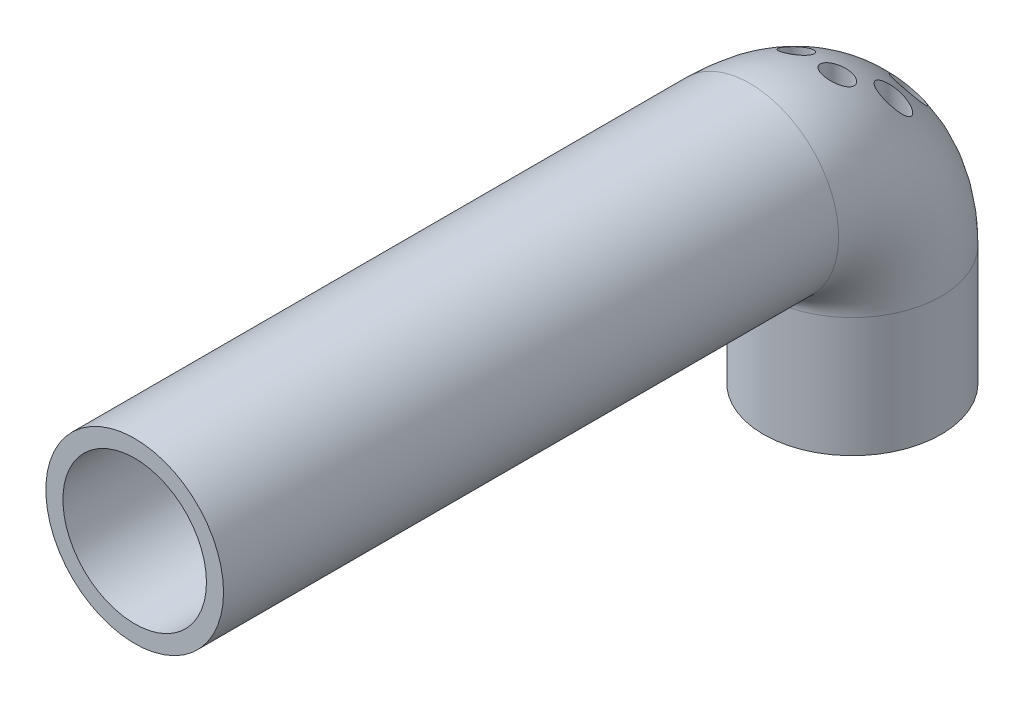
from build123d import *

# Parameters (mm, degrees)
SKETCH1_R                                       = 26
BOSS_EXTRUDE1_DEPTH                             = 5
CSK_FOR_M4_FLAT_HEAD_MACHINE_SCREW2_D           = 4.5
CSK_FOR_M4_FLAT_HEAD_MACHINE_SCREW2_CSINK_D     = 8
CSK_FOR_M4_FLAT_HEAD_MACHINE_SCREW2_CSINK_ANGLE = 90
SKETCH11_R                                      = 26
SKETCH11_R_2                                    = 21
SKETCH13_R                                      = 4
CUT_EXTRUDE1_DEPTH                              = 100
SKETCH14_R                                      = 2.9
CUT_EXTRUDE2_DEPTH                              = 1
BOSS_EXTRUDE2_START                             = 150
SKETCH15_R                                      = 26
SKETCH15_R_2                                    = 21
BOSS_EXTRUDE2_DEPTH                             = 150


with BuildPart() as part:
    # Sketch1 → Boss-Extrude1 (new body)
    with BuildSketch(Plane(origin=(0, 0, 0), x_dir=(1, 0, 0), z_dir=(0, 1, 0))):
        with Locations(Location((0, 0, 0), (0, 0, 270))):
            Circle(SKETCH1_R)
    extrude(amount=BOSS_EXTRUDE1_DEPTH)

    # CSK for M4 Flat Head Machine Screw2 (through all)
    with Locations(Plane(origin=(0, 5, 0), x_dir=(1, 0, 0), z_dir=(0, 1, 0))):
        with Locations((-6, 10.392304845), (-12, 0), (12, 0), (6, 10.392304845), (-6, -10.392304845), (6, -10.392304845)):
            CounterSinkHole(CSK_FOR_M4_FLAT_HEAD_MACHINE_SCREW2_D / 2, CSK_FOR_M4_FLAT_HEAD_MACHINE_SCREW2_CSINK_D / 2, counter_sink_angle=CSK_FOR_M4_FLAT_HEAD_MACHINE_SCREW2_CSINK_ANGLE)

    # Sweep3: sweep along a path in Sketch10
    with BuildLine(Plane(origin=(0, 0, 0), x_dir=(0, 0, -1), z_dir=(1, 0, 0))) as sweep3_path:
        Line((0, 5), (0, 35))
        ThreePointArc((0, 35), (-8.786796564, 56.213203436), (-30, 65))
        Line((-30, 65), (-60, 65))
    # Sketch11 → Sweep3 (sweep)
    with BuildSketch(Plane(origin=(0, 5, 0), x_dir=(1, 0, 0), z_dir=(0, 1, 0))):
        Circle(SKETCH11_R)
        Circle(SKETCH11_R_2, mode=Mode.SUBTRACT)
    sweep(path=sweep3_path.line)

    # Sketch13 → Cut-Extrude1 (cut)
    with BuildSketch(Plane(origin=(0, 39, 0), x_dir=(-1, 0, 0), z_dir=(0, -1, 0))):
        with Locations(Location((6, 10.392304845, 0), (0, 0, 69.705875047))):
            Circle(SKETCH13_R)
        with Locations(Location((-6, 10.392304845, 0), (0, 0, 74.301849625))):
            Circle(SKETCH13_R)
        with Locations(Location((-12, 0, 0), (0, 0, 58.652479001))):
            Circle(SKETCH13_R)
        with Locations(Location((-6, -10.392304845, 0), (0, 0, 55.656646254))):
            Circle(SKETCH13_R)
        with Locations(Location((6, -10.392304845, 0), (0, 0, 46.026357991))):
            Circle(SKETCH13_R)
        with Locations(Location((12, 0, 0), (0, 0, 43.940076892))):
            Circle(SKETCH13_R)
    extrude(amount=-CUT_EXTRUDE1_DEPTH, mode=Mode.SUBTRACT)

    # Sketch14 → Cut-Extrude2 (cut)
    with BuildSketch(Plane.XZ):
        with Locations(Location((0, 8.85, 0), (0, 0, 270))):
            Circle(SKETCH14_R)
        with Locations(Location((7.664324823, -4.425, 0), (0, 0, 270))):
            Circle(SKETCH14_R)
        with Locations(Location((-7.664324823, -4.425, 0), (0, 0, 270))):
            Circle(SKETCH14_R)
    extrude(amount=-CUT_EXTRUDE2_DEPTH, mode=Mode.SUBTRACT)

    # Sketch15 → Boss-Extrude2 (add)
    with BuildSketch(Plane.XY.offset(60).offset(BOSS_EXTRUDE2_START)):
        with Locations((0, 65)):
            Circle(SKETCH15_R)
        with Locations((0, 65)):
            Circle(SKETCH15_R_2, mode=Mode.SUBTRACT)
    extrude(amount=-BOSS_EXTRUDE2_DEPTH)


solid = part.part
